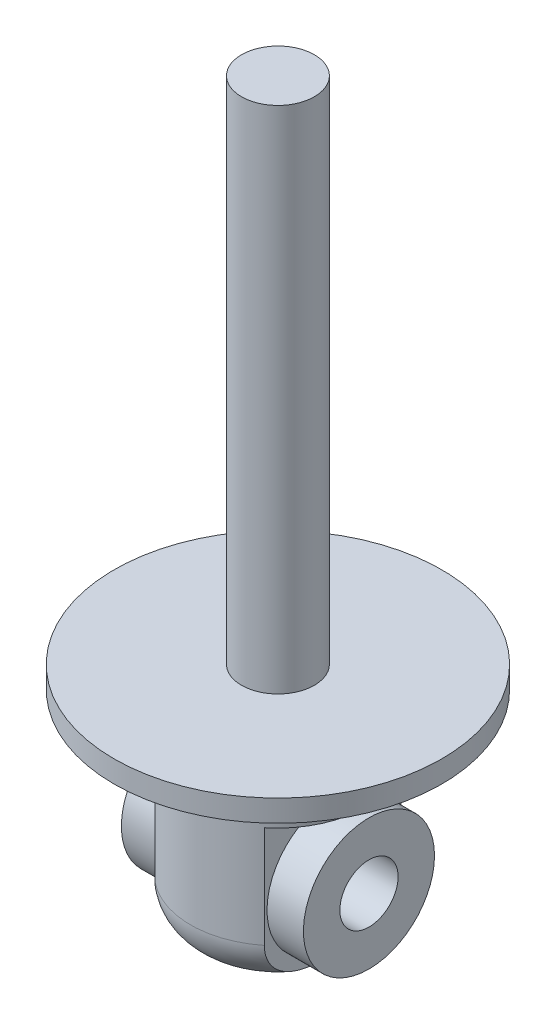
from build123d import *

# Parameters (mm, degrees)
SKETCH1_R               = 22.5
BOSS_EXTRUDE1_DEPTH     = 3
SKETCH2_R               = 5
BOSS_EXTRUDE2_DEPTH     = 70
SKETCH3_R               = 12
BOSS_EXTRUDE3_DEPTH     = 28
FILLET1_R               = 6
CUT_EXTRUDE1_DEPTH      = 80.633535649
CUT_EXTRUDE1_DEPTH_BACK = 80.633535649
SKETCH4_W               = 21.862900784
SKETCH4_H               = 20
SKETCH5_R               = 4
CUT_EXTRUDE3_DEPTH      = 83.068568892
SKETCH7_R               = 9
SKETCH7_R_2             = 4
BOSS_EXTRUDE4_DEPTH     = 12.5


with BuildPart() as part:
    # Sketch1 → Boss-Extrude1 (new body)
    with BuildSketch(Plane(origin=(0, 0, 0), x_dir=(1, 0, 0), z_dir=(0, 1, 0))):
        with Locations(Location((0, 0, 0), (0, 0, 270))):
            Circle(SKETCH1_R)
    extrude(amount=BOSS_EXTRUDE1_DEPTH)

    # Sketch2 → Boss-Extrude2 (add)
    with BuildSketch(Plane(origin=(0, 3, 0), x_dir=(1, 0, 0), z_dir=(0, 1, 0))):
        with Locations(Location((0, 0, 0), (0, 0, 270))):
            Circle(SKETCH2_R)
    extrude(amount=BOSS_EXTRUDE2_DEPTH)

    # Sketch3 → Boss-Extrude3 (add)
    with BuildSketch(Plane.XZ):
        with Locations(Location((0, 0, 0), (0, 0, 270))):
            Circle(SKETCH3_R)
    extrude(amount=BOSS_EXTRUDE3_DEPTH)

    # Fillet1
    fillet1_edges = [part.edges().sort_by_distance(p)[0] for p in [
        (0, -28, 12),
    ]]
    fillet(fillet1_edges, radius=FILLET1_R)

    # Sketch4 → Cut-Extrude1 (cut, two sides: drawn at the far end of the back side and taken through both)
    with BuildSketch(Plane.XY.offset(-CUT_EXTRUDE1_DEPTH_BACK)):
        with Locations((-18.431450392, -18)):
            Rectangle(SKETCH4_W, SKETCH4_H)
        with Locations((18.431450392, -18)):
            Rectangle(SKETCH4_W, SKETCH4_H)
    extrude(amount=CUT_EXTRUDE1_DEPTH + CUT_EXTRUDE1_DEPTH_BACK, mode=Mode.SUBTRACT)

    # Sketch5 → Cut-Extrude3 (cut, through all)
    with BuildSketch(Plane(origin=(7.5, 0, 0), x_dir=(0, 0, -1), z_dir=(1, 0, 0))):
        with Locations(Location((0, -18, 0), (0, 0, 90))):
            Circle(SKETCH5_R)
    extrude(amount=-CUT_EXTRUDE3_DEPTH, mode=Mode.SUBTRACT)

    # Sketch7 → Boss-Extrude4 (add, symmetric)
    with BuildSketch(Plane(origin=(0, 0, 0), x_dir=(0, 0, -1), z_dir=(1, 0, 0))):
        with Locations(Location((0, -18, 0), (0, 0, 270))):
            Circle(SKETCH7_R)
        with Locations(Location((0, -18, 0), (0, 0, 90))):
            Circle(SKETCH7_R_2, mode=Mode.SUBTRACT)
    extrude(amount=BOSS_EXTRUDE4_DEPTH, both=True)


solid = part.part
